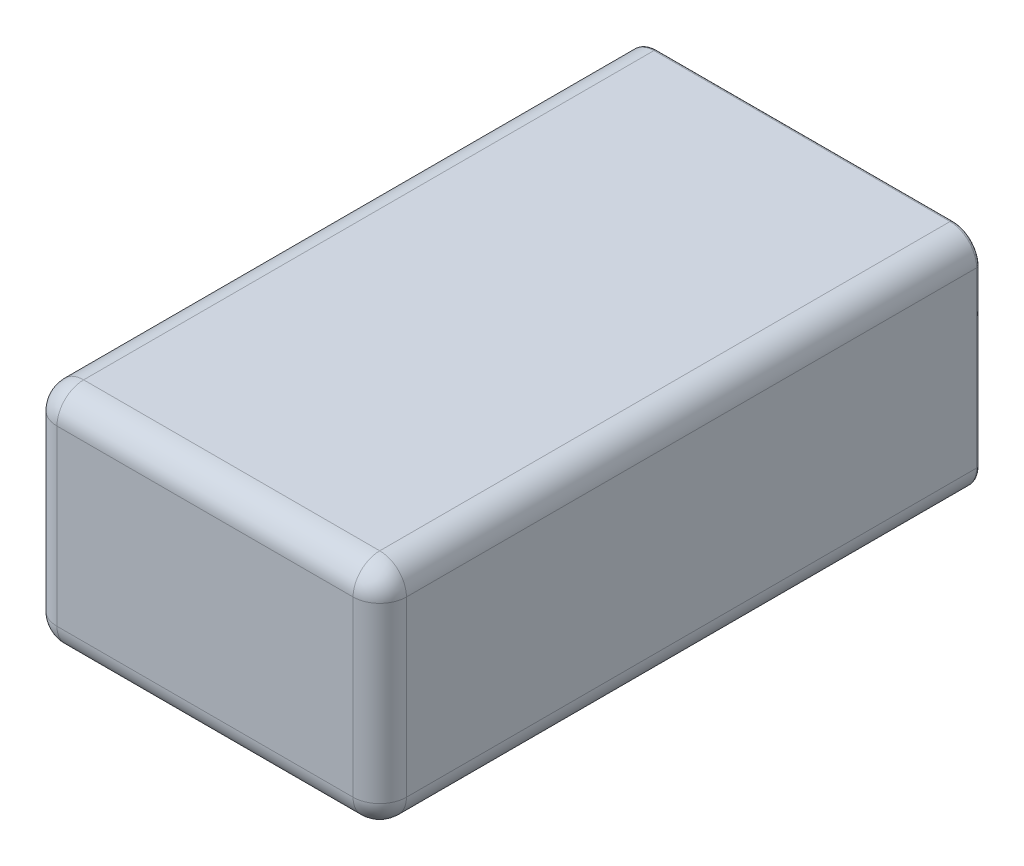
from build123d import *

# Parameters (mm, degrees)
BOSS_EXTRU_1_DEPTH      = 45
ENL_V_MAT_EXTRU_1_DEPTH = 0.5
CONG_1_R                = 0.25
CONG_2_R                = 2


with BuildPart() as part:
    # Esquisse1 → Boss.-Extru.1 (new body)
    with BuildSketch(Plane.XY):
        with BuildLine():
            Line((-11.1, 8.5), (11.1, 8.5))
            ThreePointArc((11.1, 8.5), (12.514213562, 7.914213562), (13.1, 6.5))
            Line((13.1, 6.5), (13.1, -6.5))
            ThreePointArc((13.1, -6.5), (12.514213562, -7.914213562), (11.1, -8.5))
            Line((11.1, -8.5), (-11.1, -8.5))
            ThreePointArc((-11.1, -8.5), (-12.514213562, -7.914213562), (-13.1, -6.5))
            Line((-13.1, -6.5), (-13.1, 6.5))
            ThreePointArc((-13.1, 6.5), (-12.514213562, 7.914213562), (-11.1, 8.5))
        make_face()
    extrude(amount=BOSS_EXTRU_1_DEPTH)

    # Esquisse2 → Enlèv. mat.-Extru.1 (cut)
    with BuildSketch(Plane(origin=(0, 0, 0), x_dir=(-1, 0, 0), z_dir=(0, 0, -1))):
        with BuildLine():
            Line((11.6, -6.5), (11.6, 6.5))
            ThreePointArc((11.6, 6.5), (11.453553391, 6.853553391), (11.1, 7))
            Line((11.1, 7), (-11.1, 7))
            ThreePointArc((-11.1, 7), (-11.453553391, 6.853553391), (-11.6, 6.5))
            Line((-11.6, 6.5), (-11.6, -6.5))
            ThreePointArc((-11.6, -6.5), (-11.453553391, -6.853553391), (-11.1, -7))
            Line((-11.1, -7), (11.1, -7))
            ThreePointArc((11.1, -7), (11.453553391, -6.853553391), (11.6, -6.5))
        make_face()
    extrude(amount=-ENL_V_MAT_EXTRU_1_DEPTH, mode=Mode.SUBTRACT)

    # Congé1
    cong_1_edges = [part.edges().sort_by_distance(p)[0] for p in [
        (-13.1, 0, 0),
        (-12.514213562, 7.914213562, 0),
        (-11.453553391, 6.853553391, 0),
        (0, 7, 0),
        (11.453553391, 6.853553391, 0),
        (11.6, 0, 0),
        (11.453553391, -6.853553391, 0),
        (0, -7, 0),
        (-11.453553391, -6.853553391, 0),
        (-11.6, 0, 0),
        (0, 8.5, 0),
        (12.514213562, 7.914213562, 0),
        (13.1, 0, 0),
        (12.514213562, -7.914213562, 0),
        (0, -8.5, 0),
        (-12.514213562, -7.914213562, 0),
    ]]
    fillet(cong_1_edges, radius=CONG_1_R)

    # Congé2
    cong_2_edges = [part.edges().sort_by_distance(p)[0] for p in [
        (-12.514213562, -7.914213562, 45),
        (0, -8.5, 45),
        (12.514213562, -7.914213562, 45),
        (13.1, 0, 45),
        (12.514213562, 7.914213562, 45),
        (0, 8.5, 45),
        (-12.514213562, 7.914213562, 45),
        (-13.1, 0, 45),
    ]]
    fillet(cong_2_edges, radius=CONG_2_R)


solid = part.part
